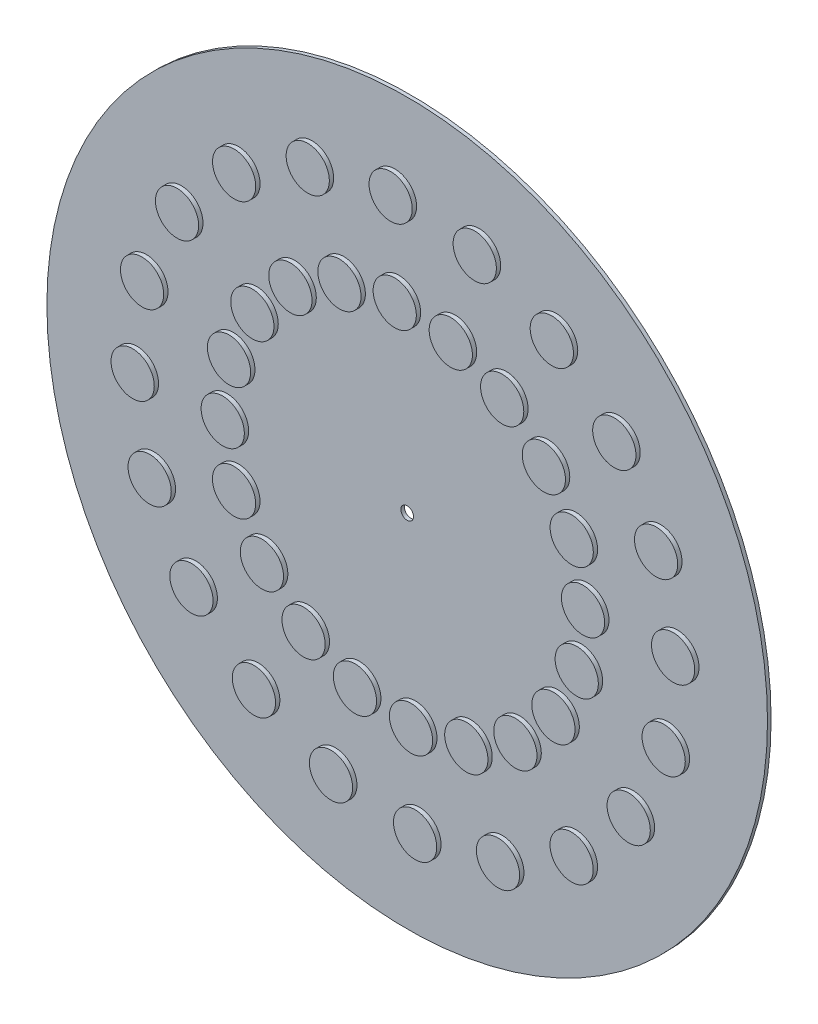
from build123d import *

# Parameters (mm, degrees)
SKETCH1_R           = 100
SKETCH1_R_2         = 1.75
BOSS_EXTRUDE1_DEPTH = 1
SKETCH2_R           = 6
BOSS_EXTRUDE2_DEPTH = 1.2


with BuildPart() as part:
    # Sketch1 → Boss-Extrude1 (new body)
    with BuildSketch(Plane.XY):
        Circle(SKETCH1_R)
        Circle(SKETCH1_R_2, mode=Mode.SUBTRACT)
    extrude(amount=BOSS_EXTRUDE1_DEPTH)

    # Sketch2 → Boss-Extrude2 (add)
    with BuildSketch(Plane.XY.offset(1)):
        with Locations((-3.396039654, 75)):
            Circle(SKETCH2_R)
        with Locations((19.946448935, 72.378672689)):
            Circle(SKETCH2_R)
        with Locations((41.336440128, 62.672416603)):
            Circle(SKETCH2_R)
        with Locations((58.680132553, 46.831347716)):
            Circle(SKETCH2_R)
        with Locations((70.279804755, 26.406100221)):
            Circle(SKETCH2_R)
        with Locations((75, 3.396039654)):
            Circle(SKETCH2_R)
        with Locations((72.378672689, -19.946448935)):
            Circle(SKETCH2_R)
        with Locations((62.672416603, -41.336440128)):
            Circle(SKETCH2_R)
        with Locations((46.831347716, -58.680132553)):
            Circle(SKETCH2_R)
        with Locations((26.406100221, -70.279804755)):
            Circle(SKETCH2_R)
        with Locations((3.396039654, -75)):
            Circle(SKETCH2_R)
        with Locations((-19.946448935, -72.378672689)):
            Circle(SKETCH2_R)
        with Locations((-41.336440128, -62.672416603)):
            Circle(SKETCH2_R)
        with Locations((-58.680132553, -46.831347716)):
            Circle(SKETCH2_R)
        with Locations((-70.279804755, -26.406100221)):
            Circle(SKETCH2_R)
        with Locations((-75, -3.396039654)):
            Circle(SKETCH2_R)
        with Locations((-72.378672689, 19.946448935)):
            Circle(SKETCH2_R)
        with Locations((-62.672416603, 41.336440128)):
            Circle(SKETCH2_R)
        with Locations((-46.831347716, 58.680132553)):
            Circle(SKETCH2_R)
        with Locations((-26.406100221, 70.279804755)):
            Circle(SKETCH2_R)
        with Locations((-2.264026436, 50)):
            Circle(SKETCH2_R)
        with Locations((13.297632623, 48.252448459)):
            Circle(SKETCH2_R)
        with Locations((27.557626752, 41.781611069)):
            Circle(SKETCH2_R)
        with Locations((39.120088369, 31.220898477)):
            Circle(SKETCH2_R)
        with Locations((46.85320317, 17.604066814)):
            Circle(SKETCH2_R)
        with Locations((50, 2.264026436)):
            Circle(SKETCH2_R)
        with Locations((48.252448459, -13.297632623)):
            Circle(SKETCH2_R)
        with Locations((41.781611069, -27.557626752)):
            Circle(SKETCH2_R)
        with Locations((31.220898477, -39.120088369)):
            Circle(SKETCH2_R)
        with Locations((17.604066814, -46.85320317)):
            Circle(SKETCH2_R)
        with Locations((2.264026436, -50)):
            Circle(SKETCH2_R)
        with Locations((-13.297632623, -48.252448459)):
            Circle(SKETCH2_R)
        with Locations((-27.557626752, -41.781611069)):
            Circle(SKETCH2_R)
        with Locations((-39.120088369, -31.220898477)):
            Circle(SKETCH2_R)
        with Locations((-46.85320317, -17.604066814)):
            Circle(SKETCH2_R)
        with Locations((-50, -2.264026436)):
            Circle(SKETCH2_R)
        with Locations((-48.252448459, 13.297632623)):
            Circle(SKETCH2_R)
        with Locations((-41.781611069, 27.557626752)):
            Circle(SKETCH2_R)
        with Locations((-31.220898477, 39.120088369)):
            Circle(SKETCH2_R)
        with Locations((-17.604066814, 46.85320317)):
            Circle(SKETCH2_R)
    extrude(amount=BOSS_EXTRUDE2_DEPTH)


solid = part.part
